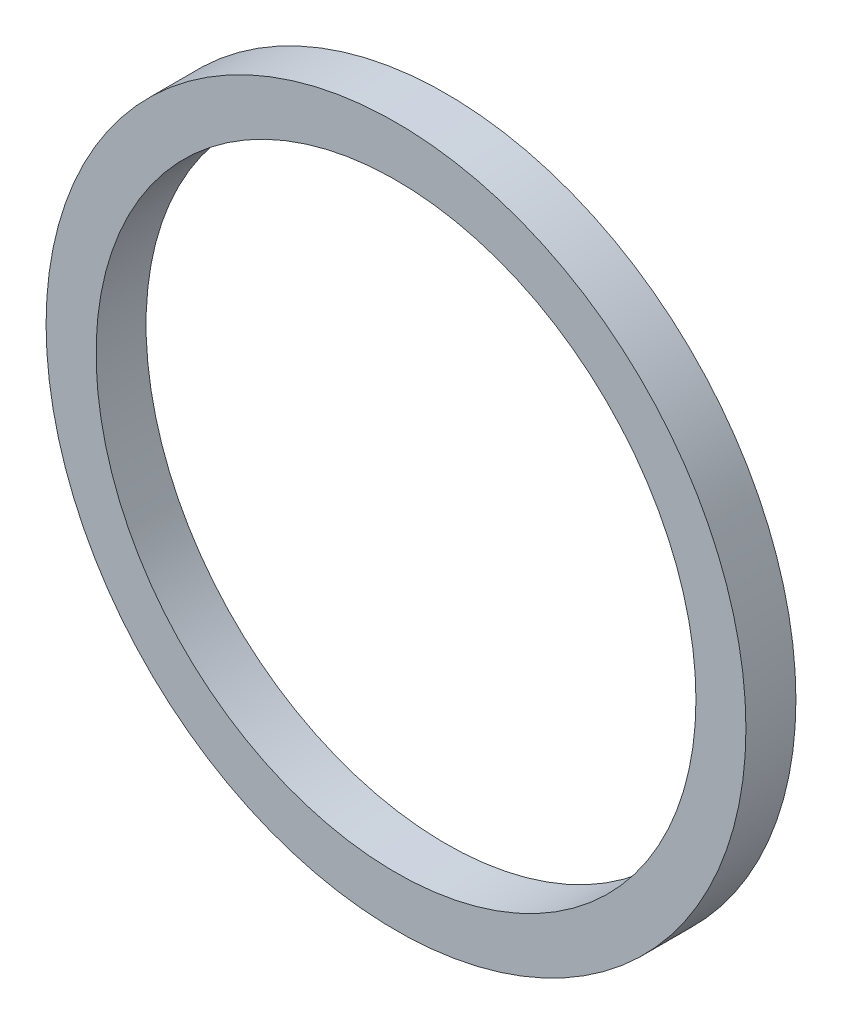
from build123d import *

# Parameters (mm, degrees)
SKETCH2_R           = 35
BOSS_EXTRUDE1_DEPTH = 2.5
SKETCH3_R           = 30
CUT_EXTRUDE1_DEPTH  = 50.749371855


with BuildPart() as part:
    # Sketch2 → Boss-Extrude1 (new, symmetric)
    with BuildSketch(Plane.XY):
        Circle(SKETCH2_R)
    extrude(amount=BOSS_EXTRUDE1_DEPTH, both=True)

    # Sketch3 → Cut-Extrude1 (cut, through all)
    with BuildSketch(Plane.XY.offset(2.5)):
        Circle(SKETCH3_R)
    extrude(amount=-CUT_EXTRUDE1_DEPTH, mode=Mode.SUBTRACT)


solid = part.part
